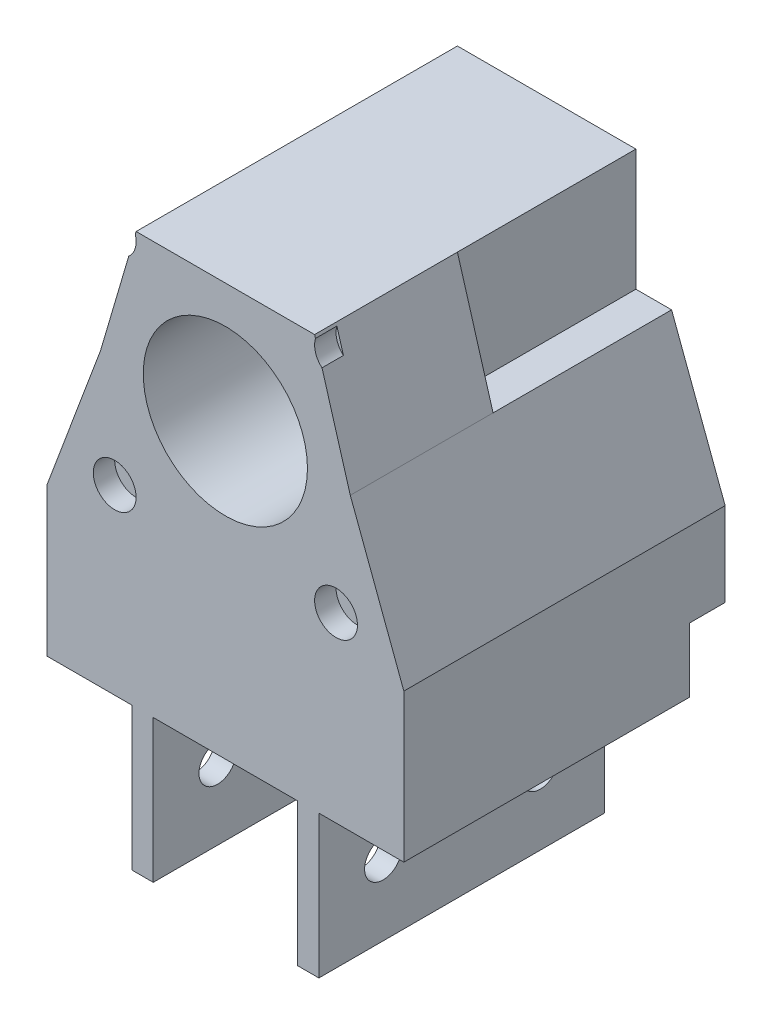
from build123d import *

# Parameters (mm, degrees)
EXTRUDE_1_DEPTH     = 40
SKETCH_2_W          = 25
SKETCH_2_H          = 47
EXTRUDE_2_DEPTH     = 40
HOLE_WIZARD_3_D     = 23
EXTRUDE_3_DEPTH     = 40
EXTRUDE_5_DEPTH     = 20
HOLE_WIZARD_4_D     = 5.2
SKETCH_15_R         = 3
CUT_EXTRUDE_1_DEPTH = 3
EXTRUDE_START       = 5
SKETCH_16_R         = 11.5
EXTRUDE_6_DEPTH     = 5


with BuildPart() as part:
    # 草图1 → 凸台-拉伸1 (new body)
    with BuildSketch(Plane.XY):
        Polygon((13.1, -5.375), (13.1, -25.375), (10.1, -25.375), (10.1, -5.375), (-10.1, -5.375), (-10.1, -25.375), (-13.1, -25.375), (-13.1, -5.375), (-25, -5.375), (-25, 5.375), (25, 5.375), (25, -5.375), align=None)
    extrude(amount=EXTRUDE_1_DEPTH)

    # 草图2 → 凸台-拉伸2 (add)
    with BuildSketch(Plane(origin=(0, 0, 0), x_dir=(-1, 0, 0), z_dir=(0, 0, -1))):
        with Locations((0, 28.875)):
            Rectangle(SKETCH_2_W, SKETCH_2_H)
    extrude(amount=-EXTRUDE_2_DEPTH)

    # 孔3 (through all)
    with Locations(Plane.XY.offset(40)):
        with Locations((0, 35.625)):
            Hole(HOLE_WIZARD_3_D / 2)

    # 草图10 → 凸台-拉伸3 (add)
    with BuildSketch(Plane.XY.offset(40)):
        Polygon((12.5, 35.375), (17.5, 35.375), (25, 15.375), (25, 5.375), (12.5, 5.375), align=None)
        Polygon((-12.5, 35.375), (-12.5, 5.375), (-25, 5.375), (-25, 15.375), (-17.5, 35.375), align=None)
    extrude(amount=-EXTRUDE_3_DEPTH)

    # 草图12 → 凸台-拉伸5 (add)
    with BuildSketch(Plane.XY.offset(40)):
        Polygon((12.5, 52.375), (17.5, 35.375), (12.5, 35.375), align=None)
        Polygon((-12.5, 52.375), (-17.5, 35.375), (-12.5, 35.375), align=None)
    extrude(amount=-EXTRUDE_5_DEPTH)

    # 孔4 (through all)
    with Locations(Plane(origin=(13.1, 0, 0), x_dir=(0, 0, -1), z_dir=(1, 0, 0))):
        with Locations((-31, -15.375), (-9, -15.375)):
            Hole(HOLE_WIZARD_4_D / 2)

    # 草图15 → 切除-拉伸1 (cut)
    with BuildSketch(Plane.XY.offset(40)):
        with Locations((-15.5, 51.125)):
            Circle(SKETCH_15_R)
        with Locations((15.5, 51.125)):
            Circle(SKETCH_15_R)
        with Locations((-15.5, 20.125)):
            Circle(SKETCH_15_R)
        with Locations((15.5, 20.125)):
            Circle(SKETCH_15_R)
    extrude(amount=-CUT_EXTRUDE_1_DEPTH, mode=Mode.SUBTRACT)

    # 草图16 → 凸台-拉伸6 (add)
    with BuildSketch(Plane(origin=(0, 0, 0), x_dir=(-1, 0, 0), z_dir=(0, 0, -1)).offset(EXTRUDE_START)):
        Polygon((-25, 3.625), (25, 3.625), (25, 15.375), (17.5, 35.375), (12.5, 35.375), (12.5, 52.375), (-12.5, 52.375), (-12.5, 35.375), (-17.5, 35.375), (-25, 15.375), align=None)
        with Locations(Location((0, 35.625, 0), (0, 0, 180))):
            Circle(SKETCH_16_R, mode=Mode.SUBTRACT)
    extrude(amount=-EXTRUDE_6_DEPTH)


solid = part.part
